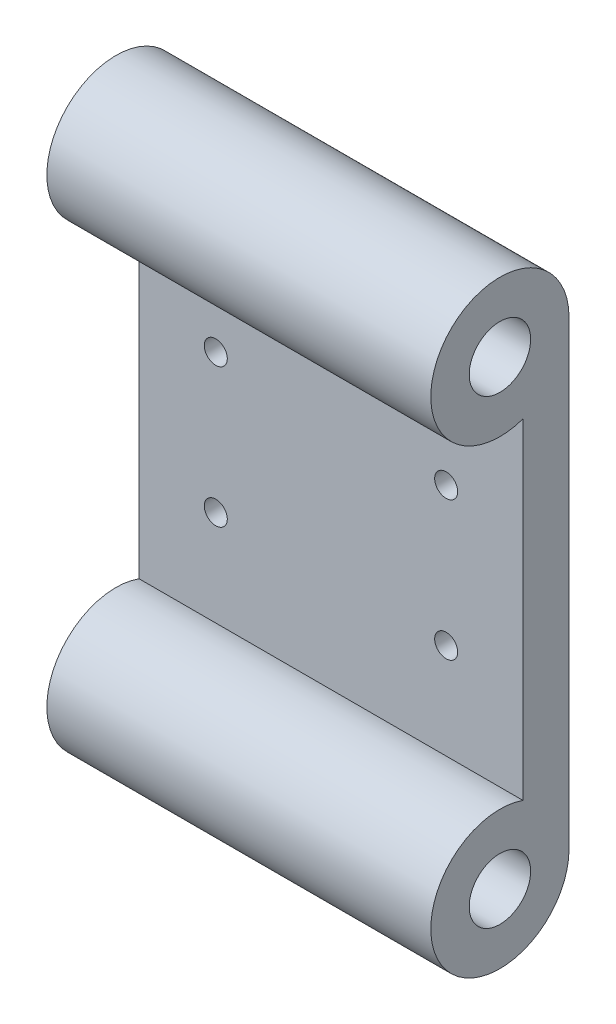
from build123d import *

# Parameters (mm, degrees)
ESBO_O2_R                = 4
RESSALTO_EXTRUS_O1_DEPTH = 50
ESBO_O5_R                = 1.5
CORTE_EXTRUS_O2_DEPTH    = 40


with BuildPart() as part:
    # Esboço2 → Ressalto-extrusão1 (new body)
    with BuildSketch(Plane(origin=(0, 0, 0), x_dir=(0, 0, -1), z_dir=(1, 0, 0))):
        with BuildLine():
            Line((9, 30), (9, -30))
            ThreePointArc((9, -30), (-7.348469228, -35.196152423), (3, -21.514718626))
            Line((3, -21.514718626), (3, 21.514718626))
            ThreePointArc((3, 21.514718626), (-7.348469228, 35.196152423), (9, 30))
        make_face()
        with Locations((0, 30)):
            Circle(ESBO_O2_R, mode=Mode.SUBTRACT)
        with Locations((0, -30)):
            Circle(ESBO_O2_R, mode=Mode.SUBTRACT)
    extrude(amount=RESSALTO_EXTRUS_O1_DEPTH)

    # Esboço5 → Corte-extrusão2 (cut)
    with BuildSketch(Plane.XY.offset(-3)):
        with Locations((10, 9.044428523)):
            Circle(ESBO_O5_R)
        with Locations((40, 9.044428523)):
            Circle(ESBO_O5_R)
        with Locations((40, -9.044428523)):
            Circle(ESBO_O5_R)
        with Locations((10, -9.044428523)):
            Circle(ESBO_O5_R)
    extrude(amount=-CORTE_EXTRUS_O2_DEPTH, mode=Mode.SUBTRACT)


solid = part.part
